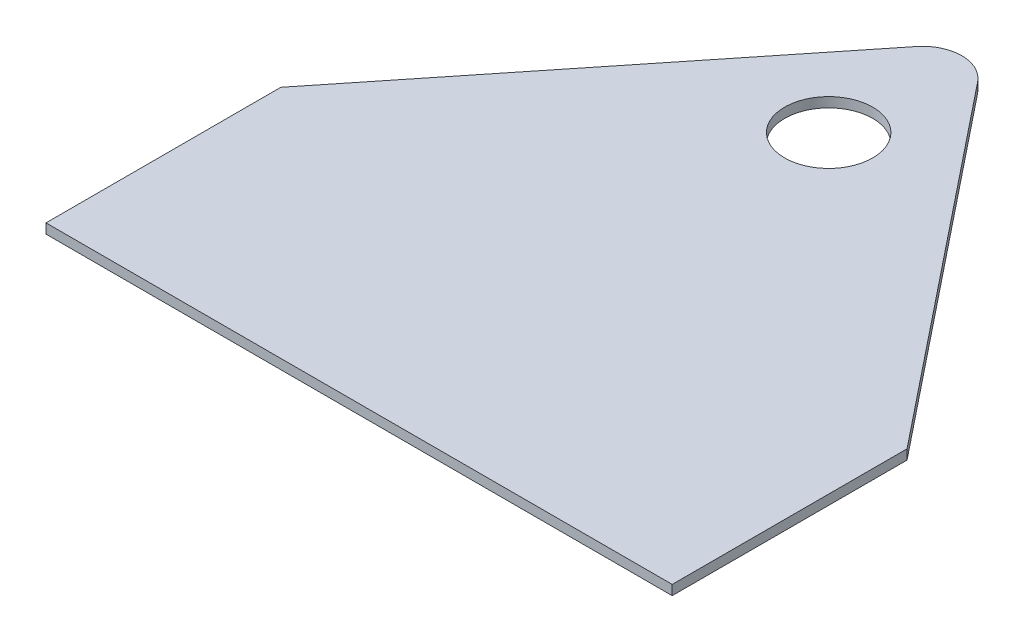
from build123d import *

# Parameters (mm, degrees)
BOSS_EXTRUDE1_DEPTH = 1.5875
CUT_EXTRUDE1_REACH  = 222.409
SKETCH3_R           = 14.2875


with BuildPart() as part:
    # Sketch2 → Boss-Extrude1 (new, symmetric)
    with BuildSketch(Plane(origin=(0, 0, 0), x_dir=(1, 0, 0), z_dir=(0, 1, 0))):
        with BuildLine():
            Line((-101.6, 0), (101.6, 0))
            Line((101.6, 0), (101.6, 76.2))
            Line((101.6, 76.2), (9.91703388, 190.80370765))
            ThreePointArc((9.91703388, 190.80370765), (0, 195.570080546), (-9.91703388, 190.80370765))
            Line((-9.91703388, 190.80370765), (-101.6, 76.2))
            Line((-101.6, 76.2), (-101.6, 0))
        make_face()
    extrude(amount=BOSS_EXTRUDE1_DEPTH, both=True)

    # Sketch3 → Cut-Extrude1 (cut, up to next)
    with BuildSketch(Plane(origin=(0, 1.5875, 0), x_dir=(1, 0, 0), z_dir=(0, 1, 0)), mode=Mode.PRIVATE) as cut_extrude1_sk1:
        with Locations(Location((0, 152.375201365, 0), (0, 0, 270))):
            Circle(SKETCH3_R)
    cut_extrude1_tool1 = extrude(cut_extrude1_sk1.sketch, amount=-CUT_EXTRUDE1_REACH, mode=Mode.PRIVATE) & part.part
    add(cut_extrude1_tool1.solids().sort_by_distance((0, 1.5875, -152.375201))[0], mode=Mode.SUBTRACT)


solid = part.part
